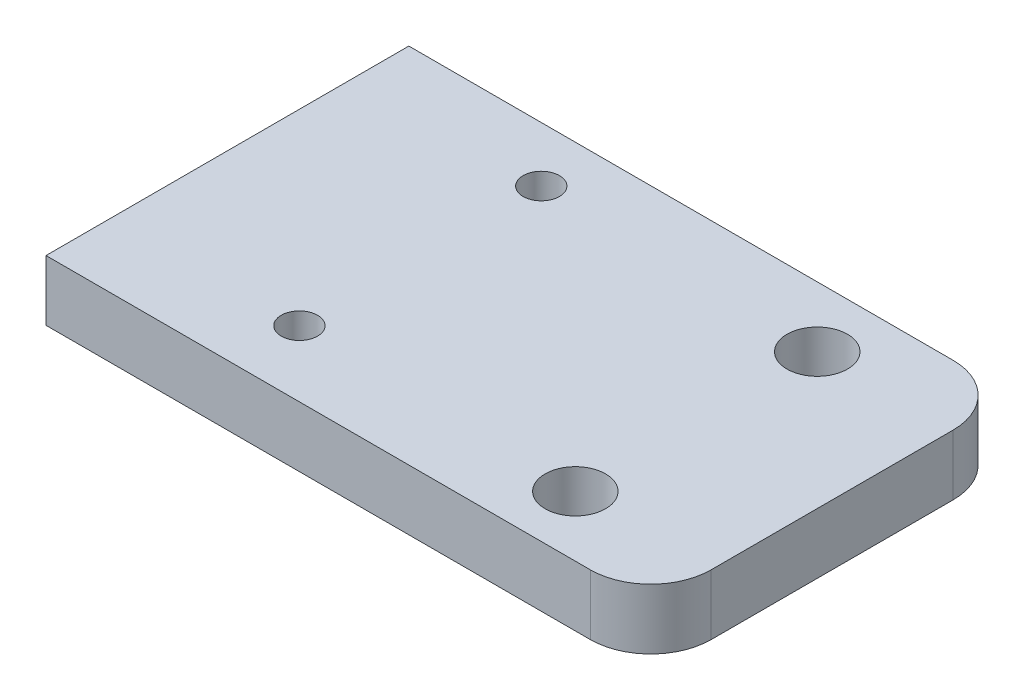
from build123d import *

# Parameters (mm, degrees)
SKETCH1_W           = 50
SKETCH1_H           = 30
SKETCH1_R           = 1.5
BOSS_EXTRUDE1_DEPTH = 5
FILLET1_R           = 5
SKETCH2_R           = 2.5
CUT_EXTRUDE1_DEPTH  = 9


with BuildPart() as part:
    # Sketch1 → Boss-Extrude1 (new body)
    with BuildSketch(Plane(origin=(0, 0, 0), x_dir=(1, 0, 0), z_dir=(0, 1, 0))):
        with Locations((-25, 15)):
            Rectangle(SKETCH1_W, SKETCH1_H)
        with Locations(Location((-34.5, 5.45, 0), (0, 0, 270))):
            Circle(SKETCH1_R, mode=Mode.SUBTRACT)
        with Locations(Location((-34.5, 25.45, 0), (0, 0, 270))):
            Circle(SKETCH1_R, mode=Mode.SUBTRACT)
    extrude(amount=BOSS_EXTRUDE1_DEPTH)

    # Fillet1
    fillet1_edges = [part.edges().sort_by_distance(p)[0] for p in [
        (0, 2.5, 0),
        (0, 2.5, -30),
    ]]
    fillet(fillet1_edges, radius=FILLET1_R)

    # Sketch2 → Cut-Extrude1 (cut)
    with BuildSketch(Plane.XZ):
        with Locations(Location((-11.23257698, -5, 0), (0, 0, 270))):
            Circle(SKETCH2_R)
        with Locations(Location((-11.23257698, -25, 0), (0, 0, 270))):
            Circle(SKETCH2_R)
    extrude(amount=-CUT_EXTRUDE1_DEPTH, mode=Mode.SUBTRACT)


solid = part.part
